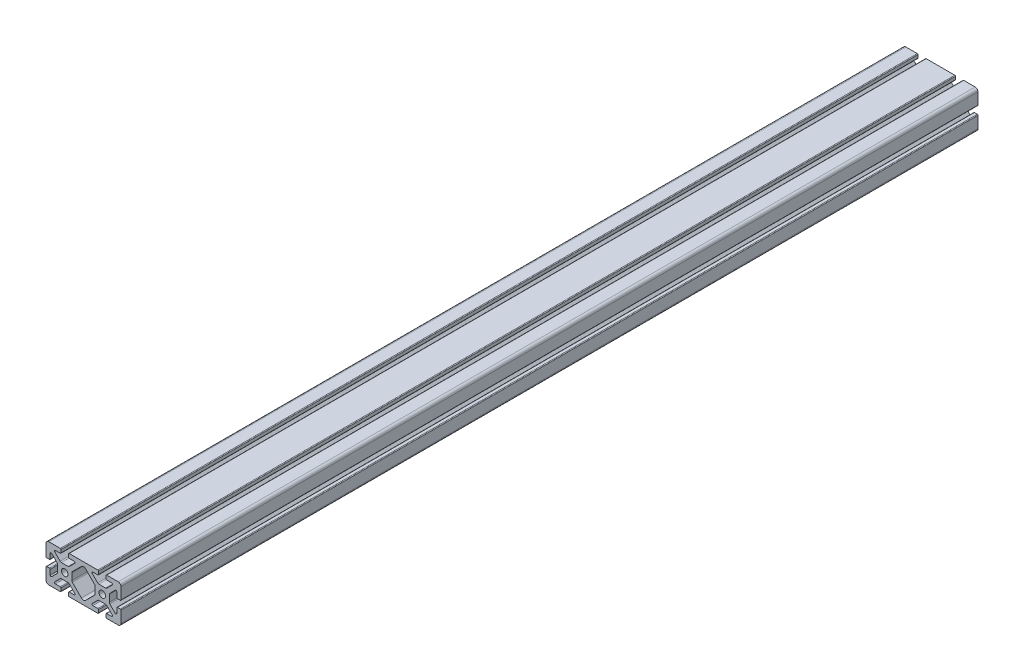
from build123d import *

# Parameters (mm, degrees)
SKETCH3_R           = 3.5
BOSS_EXTRUDE1_DEPTH = 457.2


with BuildPart() as part:
    # Sketch3 → Boss-Extrude1 (new, symmetric)
    with BuildSketch(Plane.XY):
        with BuildLine():
            Line((15.25, 20), (-15.25, 20))
            ThreePointArc((-15.25, 20), (-15.780330086, 19.780330086), (-16, 19.25))
            Line((-16, 19.25), (-16, 16.25))
            ThreePointArc((-16, 16.25), (-15.780330086, 15.719669914), (-15.25, 15.5))
            Line((-15.25, 15.5), (-9.931980515, 15.5))
            ThreePointArc((-9.931980515, 15.5), (-9.070942793, 14.924672987), (-9.272970773, 13.909009742))
            Line((-9.272970773, 13.909009742), (-15.140128061, 8.041852455))
            ThreePointArc((-15.140128061, 8.041852455), (-15.740311256, 7.640822865), (-16.448275606, 7.5))
            Line((-16.448275606, 7.5), (-23.551724394, 7.5))
            ThreePointArc((-23.551724394, 7.5), (-24.259688744, 7.640822865), (-24.859871939, 8.041852455))
            Line((-24.859871939, 8.041852455), (-30.727029227, 13.909009742))
            ThreePointArc((-30.727029227, 13.909009742), (-30.929057207, 14.924672987), (-30.068019485, 15.5))
            Line((-30.068019485, 15.5), (-24.75, 15.5))
            ThreePointArc((-24.75, 15.5), (-24.219669914, 15.719669914), (-24, 16.25))
            Line((-24, 16.25), (-24, 19.25))
            ThreePointArc((-24, 19.25), (-24.219669914, 19.780330086), (-24.75, 20))
            Line((-24.75, 20), (-37, 20))
            ThreePointArc((-37, 20), (-39.121320344, 19.121320344), (-40, 17))
            Line((-40, 17), (-40, 4.75))
            ThreePointArc((-40, 4.75), (-39.780330086, 4.219669914), (-39.25, 4))
            Line((-39.25, 4), (-36.25, 4))
            ThreePointArc((-36.25, 4), (-35.719669914, 4.219669914), (-35.5, 4.75))
            Line((-35.5, 4.75), (-35.5, 10.068019485))
            ThreePointArc((-35.5, 10.068019485), (-34.924672987, 10.929057207), (-33.909009742, 10.727029227))
            Line((-33.909009742, 10.727029227), (-28.041852455, 4.859871939))
            ThreePointArc((-28.041852455, 4.859871939), (-27.640822865, 4.259688744), (-27.5, 3.551724394))
            Line((-27.5, 3.551724394), (-27.5, -3.551724394))
            ThreePointArc((-27.5, -3.551724394), (-27.640822865, -4.259688744), (-28.041852455, -4.859871939))
            Line((-28.041852455, -4.859871939), (-33.909009742, -10.727029227))
            ThreePointArc((-33.909009742, -10.727029227), (-34.924672987, -10.929057207), (-35.5, -10.068019485))
            Line((-35.5, -10.068019485), (-35.5, -4.75))
            ThreePointArc((-35.5, -4.75), (-35.719669914, -4.219669914), (-36.25, -4))
            Line((-36.25, -4), (-39.25, -4))
            ThreePointArc((-39.25, -4), (-39.780330086, -4.219669914), (-40, -4.75))
            Line((-40, -4.75), (-40, -17))
            ThreePointArc((-40, -17), (-39.121320344, -19.121320344), (-37, -20))
            Line((-37, -20), (-24.75, -20))
            ThreePointArc((-24.75, -20), (-24.219669914, -19.780330086), (-24, -19.25))
            Line((-24, -19.25), (-24, -16.25))
            ThreePointArc((-24, -16.25), (-24.219669914, -15.719669914), (-24.75, -15.5))
            Line((-24.75, -15.5), (-30.068019485, -15.5))
            ThreePointArc((-30.068019485, -15.5), (-30.929057207, -14.924672987), (-30.727029227, -13.909009742))
            Line((-30.727029227, -13.909009742), (-24.859871939, -8.041852455))
            ThreePointArc((-24.859871939, -8.041852455), (-24.259688744, -7.640822865), (-23.551724394, -7.5))
            Line((-23.551724394, -7.5), (-16.448275606, -7.5))
            ThreePointArc((-16.448275606, -7.5), (-15.740311256, -7.640822865), (-15.140128061, -8.041852455))
            Line((-15.140128061, -8.041852455), (-9.272970773, -13.909009742))
            ThreePointArc((-9.272970773, -13.909009742), (-9.070942793, -14.924672987), (-9.931980515, -15.5))
            Line((-9.931980515, -15.5), (-15.25, -15.5))
            ThreePointArc((-15.25, -15.5), (-15.780330086, -15.719669914), (-16, -16.25))
            Line((-16, -16.25), (-16, -19.25))
            ThreePointArc((-16, -19.25), (-15.780330086, -19.780330086), (-15.25, -20))
            Line((-15.25, -20), (15.25, -20))
            ThreePointArc((15.25, -20), (15.780330086, -19.780330086), (16, -19.25))
            Line((16, -19.25), (16, -16.25))
            ThreePointArc((16, -16.25), (15.780330086, -15.719669914), (15.25, -15.5))
            Line((15.25, -15.5), (9.931980515, -15.5))
            ThreePointArc((9.931980515, -15.5), (9.070942793, -14.924672987), (9.272970773, -13.909009742))
            Line((9.272970773, -13.909009742), (15.140128061, -8.041852455))
            ThreePointArc((15.140128061, -8.041852455), (15.740311256, -7.640822865), (16.448275606, -7.5))
            Line((16.448275606, -7.5), (23.551724394, -7.5))
            ThreePointArc((23.551724394, -7.5), (24.259688744, -7.640822865), (24.859871939, -8.041852455))
            Line((24.859871939, -8.041852455), (30.727029227, -13.909009742))
            ThreePointArc((30.727029227, -13.909009742), (30.929057207, -14.924672987), (30.068019485, -15.5))
            Line((30.068019485, -15.5), (24.75, -15.5))
            ThreePointArc((24.75, -15.5), (24.219669914, -15.719669914), (24, -16.25))
            Line((24, -16.25), (24, -19.25))
            ThreePointArc((24, -19.25), (24.219669914, -19.780330086), (24.75, -20))
            Line((24.75, -20), (37, -20))
            ThreePointArc((37, -20), (39.121320344, -19.121320344), (40, -17))
            Line((40, -17), (40, -4.75))
            ThreePointArc((40, -4.75), (39.780330086, -4.219669914), (39.25, -4))
            Line((39.25, -4), (36.25, -4))
            ThreePointArc((36.25, -4), (35.719669914, -4.219669914), (35.5, -4.75))
            Line((35.5, -4.75), (35.5, -10.068019485))
            ThreePointArc((35.5, -10.068019485), (34.924672987, -10.929057207), (33.909009742, -10.727029227))
            Line((33.909009742, -10.727029227), (28.041852455, -4.859871939))
            ThreePointArc((28.041852455, -4.859871939), (27.640822865, -4.259688744), (27.5, -3.551724394))
            Line((27.5, -3.551724394), (27.5, 3.551724394))
            ThreePointArc((27.5, 3.551724394), (27.640822865, 4.259688744), (28.041852455, 4.859871939))
            Line((28.041852455, 4.859871939), (33.909009742, 10.727029227))
            ThreePointArc((33.909009742, 10.727029227), (34.924672987, 10.929057207), (35.5, 10.068019485))
            Line((35.5, 10.068019485), (35.5, 4.75))
            ThreePointArc((35.5, 4.75), (35.719669914, 4.219669914), (36.25, 4))
            Line((36.25, 4), (39.25, 4))
            ThreePointArc((39.25, 4), (39.780330086, 4.219669914), (40, 4.75))
            Line((40, 4.75), (40, 17))
            ThreePointArc((40, 17), (39.121320344, 19.121320344), (37, 20))
            Line((37, 20), (24.75, 20))
            ThreePointArc((24.75, 20), (24.219669914, 19.780330086), (24, 19.25))
            Line((24, 19.25), (24, 16.25))
            ThreePointArc((24, 16.25), (24.219669914, 15.719669914), (24.75, 15.5))
            Line((24.75, 15.5), (30.068019485, 15.5))
            ThreePointArc((30.068019485, 15.5), (30.929057207, 14.924672987), (30.727029227, 13.909009742))
            Line((30.727029227, 13.909009742), (24.859871939, 8.041852455))
            ThreePointArc((24.859871939, 8.041852455), (24.259688744, 7.640822865), (23.551724394, 7.5))
            Line((23.551724394, 7.5), (16.448275606, 7.5))
            ThreePointArc((16.448275606, 7.5), (15.740311256, 7.640822865), (15.140128061, 8.041852455))
            Line((15.140128061, 8.041852455), (9.272970773, 13.909009742))
            ThreePointArc((9.272970773, 13.909009742), (9.070942793, 14.924672987), (9.931980515, 15.5))
            Line((9.931980515, 15.5), (15.25, 15.5))
            ThreePointArc((15.25, 15.5), (15.780330086, 15.719669914), (16, 16.25))
            Line((16, 16.25), (16, 19.25))
            ThreePointArc((16, 19.25), (15.780330086, 19.780330086), (15.25, 20))
        make_face()
        with Locations((-20, 0)):
            Circle(SKETCH3_R, mode=Mode.SUBTRACT)
        with Locations(Location((20, 0, 0), (0, 0, 180))):
            Circle(SKETCH3_R, mode=Mode.SUBTRACT)
        with BuildLine():
            Line((-2.25, -14.568019485), (-11.958147545, -4.859871939))
            ThreePointArc((-11.958147545, -4.859871939), (-12.359177135, -4.259688744), (-12.5, -3.551724394))
            Line((-12.5, -3.551724394), (-12.5, 3.551724394))
            ThreePointArc((-12.5, 3.551724394), (-12.359177135, 4.259688744), (-11.958147545, 4.859871939))
            Line((-11.958147545, 4.859871939), (-2.25, 14.568019485))
            ThreePointArc((-2.25, 14.568019485), (0, 15.5), (2.25, 14.568019485))
            Line((2.25, 14.568019485), (11.958147545, 4.859871939))
            ThreePointArc((11.958147545, 4.859871939), (12.359177135, 4.259688744), (12.5, 3.551724394))
            Line((12.5, 3.551724394), (12.5, -3.551724394))
            ThreePointArc((12.5, -3.551724394), (12.359177135, -4.259688744), (11.958147545, -4.859871939))
            Line((11.958147545, -4.859871939), (2.25, -14.568019485))
            ThreePointArc((2.25, -14.568019485), (0, -15.5), (-2.25, -14.568019485))
        make_face(mode=Mode.SUBTRACT)
    extrude(amount=BOSS_EXTRUDE1_DEPTH, both=True)


solid = part.part
